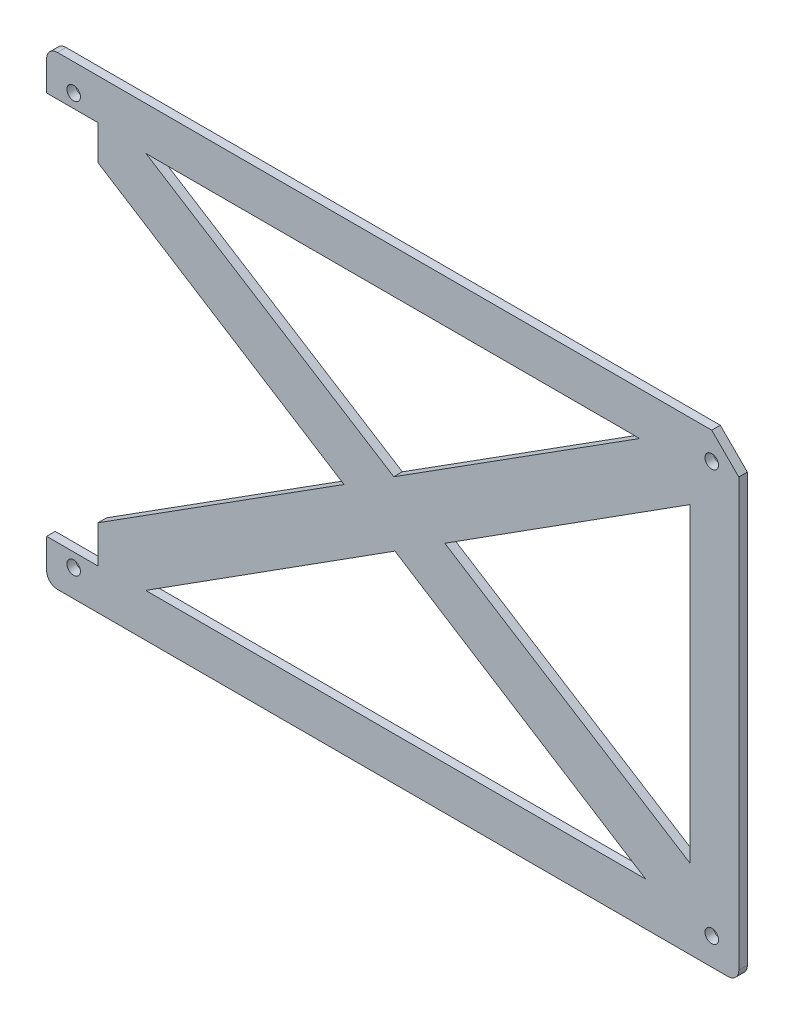
from build123d import *

# Parameters (mm, degrees)
SKETCH2_R           = 1.249995
BOSS_EXTRUDE1_DEPTH = 1.5875


with BuildPart() as part:
    # Sketch2 → Boss-Extrude1 (new body)
    with BuildSketch(Plane.XY):
        with BuildLine():
            Line((64.000000001, -40.999999999), (64.000000001, 37.999999999))
            Line((64.000000001, 37.999999999), (59.000000001, 42.999999999))
            Line((59.000000001, 42.999999999), (-62, 42.999999999))
            ThreePointArc((-62, 42.999999999), (-63.414213563, 42.414213561), (-64.000000001, 40.999999999))
            Line((-64.000000001, 40.999999999), (-64.000000001, 35.5))
            Line((-64.000000001, 35.5), (-54.500000001, 35.5))
            Line((-54.500000001, 35.5), (-54.500000001, 29.086543683))
            Line((-54.500000001, 29.086543683), (-9.009111538, 0.298612306))
            Line((-9.009111538, 0.298612306), (-54.500000001, -28.57300784))
            Line((-54.500000001, -28.57300784), (-54.500000001, -35.5))
            Line((-54.500000001, -35.5), (-64.000000001, -35.5))
            Line((-64.000000001, -35.5), (-64.000000001, -40.999999999))
            ThreePointArc((-64.000000001, -40.999999999), (-63.414213563, -42.414213561), (-62, -42.999999999))
            Line((-62, -42.999999999), (62, -42.999999999))
            ThreePointArc((62, -42.999999999), (63.414213563, -42.414213561), (64.000000001, -40.999999999))
        make_face()
        with Locations((59.000000001, -38)):
            Circle(SKETCH2_R, mode=Mode.SUBTRACT)
        with Locations((-59.000000001, -38)):
            Circle(SKETCH2_R, mode=Mode.SUBTRACT)
        with Locations((59.000000001, 37.999999999)):
            Circle(SKETCH2_R, mode=Mode.SUBTRACT)
        with Locations((-59.000000001, 37.999999999)):
            Circle(SKETCH2_R, mode=Mode.SUBTRACT)
        Polygon((-45.624235778, 34.999999999), (45.667312892, 34.999999999), (0.200195404, 6.143466535), align=None, mode=Mode.SUBTRACT)
        Polygon((-45.681229003, -34.999999999), (46.769999999, -34.999999999), (0.409618796, -5.661828822), align=None, mode=Mode.SUBTRACT)
        Polygon((55.000000001, 29.086543683), (55.000000001, -28.365033721), (9.628517212, 0.206269351), align=None, mode=Mode.SUBTRACT)
    extrude(amount=BOSS_EXTRUDE1_DEPTH)


solid = part.part
